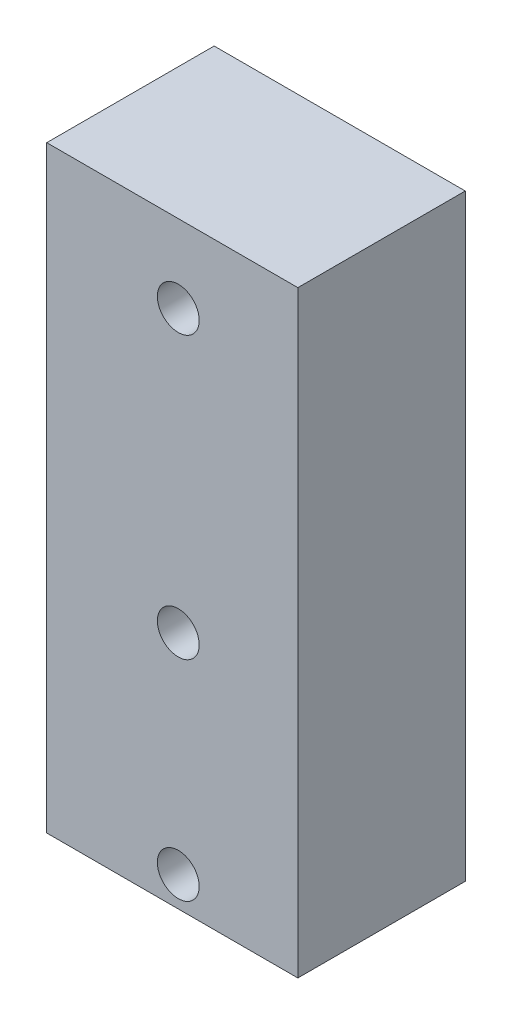
from build123d import *

# Parameters (mm, degrees)
SKETCH1_W           = 21
SKETCH1_H           = 14
BOSS_EXTRUDE1_DEPTH = 50
SKETCH2_R           = 1.75
CUT_EXTRUDE1_DEPTH  = 100
SKETCH3_R           = 1.75
CUT_EXTRUDE2_DEPTH  = 22


with BuildPart() as part:
    # Sketch1 → Boss-Extrude1 (new body)
    with BuildSketch(Plane(origin=(0, 0, 0), x_dir=(1, 0, 0), z_dir=(0, 1, 0))):
        with Locations((-0.5, 4.045454545)):
            Rectangle(SKETCH1_W, SKETCH1_H)
    extrude(amount=BOSS_EXTRUDE1_DEPTH)

    # Sketch2 → Cut-Extrude1 (cut)
    with BuildSketch(Plane.XY.offset(2.954545455)):
        with Locations((0, 2.5)):
            Circle(SKETCH2_R)
        with Locations((0, 20)):
            Circle(SKETCH2_R)
    extrude(amount=-CUT_EXTRUDE1_DEPTH, mode=Mode.SUBTRACT)

    # Sketch3 → Cut-Extrude2 (cut)
    with BuildSketch(Plane(origin=(0, 0, -11.045454545), x_dir=(-1, 0, 0), z_dir=(0, 0, -1))):
        with Locations((0, 43.5)):
            Circle(SKETCH3_R)
    extrude(amount=-CUT_EXTRUDE2_DEPTH, mode=Mode.SUBTRACT)


solid = part.part
